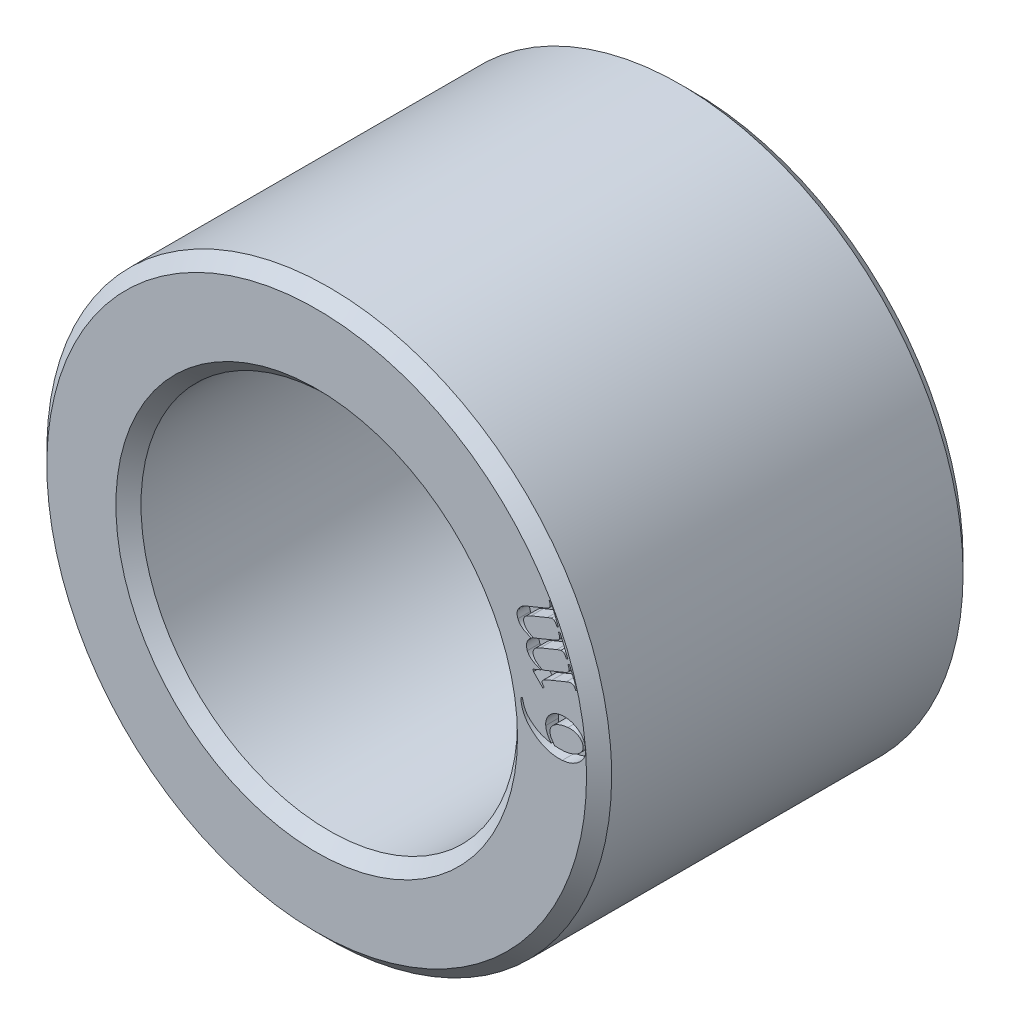
from build123d import *

# Parameters (mm, degrees)
ESQUISSE1_R             = 4.5
ESQUISSE1_R_2           = 3
BOSS_EXTRU_1_DEPTH      = 6
CHANFREIN1_SIZE         = 0.2
ENL_V_MAT_EXTRU_1_DEPTH = 0.2


with BuildPart() as part:
    # Esquisse1 → Boss.-Extru.1 (new body)
    with BuildSketch(Plane.XY):
        Circle(ESQUISSE1_R)
        Circle(ESQUISSE1_R_2, mode=Mode.SUBTRACT)
    extrude(amount=BOSS_EXTRU_1_DEPTH)

    # Chanfrein1
    chanfrein1_edges = [part.edges().sort_by_distance(p)[0] for p in [
        (-4.5, 0, 0),
        (-4.5, 0, 6),
        (-3, 0, 0),
        (-3, 0, 6),
    ]]
    chamfer(chanfrein1_edges, length=CHANFREIN1_SIZE)

    # Esquisse2 → Enlèv. mat.-Extru.1 (cut)
    # profile 1 of 2: a face of its own
    with BuildSketch(Plane.XY.offset(6)):
        with BuildLine():
            Line((3.25194932, 0.572860765), (3.278490311, 0.574984044))
            add(Edge.make_bspline(
                [(3.278490311, 0.574984044), (3.281525389, 0.560067916), (3.287325905, 0.531560827), (3.299139738, 0.491417619), (3.312428476, 0.455575734), (3.32856748, 0.423739737), (3.347549471, 0.394522298), (3.370170581, 0.366705743), (3.396057147, 0.339005764), (3.425556445, 0.312434456), (3.457531203, 0.287353528), (3.491355803, 0.264656236), (3.526450285, 0.24431234), (3.563493528, 0.226775229), (3.602772028, 0.211360089), (3.645165909, 0.198401935), (3.69049705, 0.186484074), (3.722138987, 0.180693134), (3.738392616, 0.17771848)],
                knots=[0, 0, 0, 0, 1.118842627, 2.138285908, 3.073925311, 3.925799372, 4.757286829, 5.631041582, 6.558890153, 7.542636783, 8.547306681, 9.544738667, 10.535631832, 11.527317395, 12.55563609, 13.635450993, 14.785393592, 16, 16, 16, 16], degree=3))
            add(Edge.make_bspline(
                [(3.738392616, 0.17771848), (3.731969343, 0.185766501), (3.719371531, 0.201550893), (3.702943483, 0.226325912), (3.688208645, 0.250969487), (3.676268345, 0.276182645), (3.665810449, 0.301351718), (3.65830045, 0.327019795), (3.652590651, 0.352766426), (3.650621336, 0.37013432), (3.649639539, 0.378793034)],
                knots=[0, 0, 0, 0, 1.106759844, 2.170661682, 3.194045375, 4.1914293, 5.168037007, 6.121565719, 7.063511999, 8, 8, 8, 8], degree=3))
            add(Edge.make_bspline(
                [(3.649639539, 0.378793034), (3.649180584, 0.387000673), (3.648273689, 0.403218935), (3.649989637, 0.427397553), (3.654597759, 0.450832259), (3.661284811, 0.473781392), (3.671050142, 0.495871142), (3.682997614, 0.517565868), (3.697685546, 0.538535635), (3.714878375, 0.558591987), (3.734006763, 0.577435861), (3.755124603, 0.594215256), (3.777773294, 0.608984095), (3.802064004, 0.621592854), (3.828095639, 0.63170787), (3.855652817, 0.63979829), (3.884844048, 0.645815451), (3.904975142, 0.647980295), (3.915261784, 0.649086493)],
                knots=[0, 0, 0, 0, 0.934317859, 1.846208399, 2.747664738, 3.64667381, 4.558848539, 5.488473313, 6.459853244, 7.464806702, 8.489426934, 9.508975385, 10.527092846, 11.560372039, 12.615709333, 13.698234171, 14.823837356, 16, 16, 16, 16], degree=3))
            add(Edge.make_bspline(
                [(3.915261784, 0.649086493), (3.92530858, 0.649773742), (3.94525496, 0.651138171), (3.975070588, 0.649789928), (4.004502343, 0.646822891), (4.033347619, 0.640905403), (4.061825796, 0.633153662), (4.089656083, 0.622576273), (4.117146457, 0.609964162), (4.134677036, 0.599694976), (4.143514313, 0.594518214)],
                knots=[0, 0, 0, 0, 1.011416008, 2.008012301, 2.995528033, 3.981915645, 4.964009732, 5.959005107, 6.971121403, 8, 8, 8, 8], degree=3))
            add(Edge.make_bspline(
                [(4.143514313, 0.594518214), (4.153877423, 0.587891008), (4.174191154, 0.574900382), (4.201145738, 0.55177259), (4.224596998, 0.526768795), (4.244365888, 0.4995607), (4.260305903, 0.470101586), (4.272676227, 0.438594855), (4.281622222, 0.40504303), (4.284231947, 0.381745989), (4.285561701, 0.36987526)],
                knots=[0, 0, 0, 0, 1.065992641, 2.089554928, 3.071329832, 4.034165826, 4.998488403, 5.968734537, 6.964992928, 8, 8, 8, 8], degree=3))
            add(Edge.make_bspline(
                [(4.285561701, 0.36987526), (4.28606828, 0.361738656), (4.287068248, 0.345677302), (4.285903091, 0.321792836), (4.282822301, 0.298669062), (4.27735462, 0.276307547), (4.270112775, 0.254633068), (4.260039563, 0.233984999), (4.248480632, 0.213746792), (4.238995857, 0.201259567), (4.234178341, 0.194917043)],
                knots=[0, 0, 0, 0, 1.045580687, 2.063937508, 3.063361908, 4.03494871, 5.014485605, 5.989632586, 6.97889217, 8, 8, 8, 8], degree=3))
            add(Edge.make_bspline(
                [(4.234178341, 0.194917043), (4.224211203, 0.183174535), (4.204483877, 0.159933328), (4.171153298, 0.12890792), (4.134764855, 0.102390703), (4.095956178, 0.079334674), (4.054099244, 0.06094868), (4.009619708, 0.046557101), (3.962537842, 0.035644978), (3.929965522, 0.032147109), (3.913350833, 0.030362895)],
                knots=[0, 0, 0, 0, 0.995190326, 1.969717452, 2.935222583, 3.901248004, 4.882455184, 5.883759233, 6.920534871, 8, 8, 8, 8], degree=3))
            add(Edge.make_bspline(
                [(3.913350833, 0.030362895), (3.902527244, 0.029632412), (3.880968436, 0.028177412), (3.848713849, 0.027666946), (3.816761924, 0.029301846), (3.785071724, 0.032182484), (3.753602004, 0.036884462), (3.722348832, 0.043270327), (3.691359214, 0.051301967), (3.660794128, 0.061161555), (3.630598966, 0.07230535), (3.601203351, 0.085335009), (3.572393014, 0.099561515), (3.544349175, 0.115326565), (3.516938831, 0.132463948), (3.490425629, 0.151281973), (3.464353373, 0.171222662), (3.439434157, 0.192669028), (3.415886637, 0.21488539), (3.393715567, 0.23690552), (3.373458175, 0.258905444), (3.355497158, 0.281199267), (3.338816116, 0.302855581), (3.324302389, 0.324647507), (3.311730446, 0.346375013), (3.297560374, 0.374764786), (3.283439825, 0.409983309), (3.26962043, 0.451312715), (3.259966512, 0.49167758), (3.25686377, 0.5183932), (3.255346567, 0.531456818)],
                knots=[0, 0, 0, 0, 1.000630422, 1.993091248, 2.973474395, 3.950547635, 4.927424542, 5.906937746, 6.891897131, 7.8788452, 8.868402735, 9.859445237, 10.843408774, 11.831392828, 12.825870199, 13.823920105, 14.82943738, 15.852708173, 16.855019809, 17.815261441, 18.734893224, 19.611818317, 20.455346098, 21.255701328, 22.025017986, 22.76955685, 24.180801152, 25.520729362, 26.78766646, 28, 28, 28, 28], degree=3))
            Line((3.255346567, 0.531456818), (3.25194932, 0.572860765))
        make_face()
        with BuildLine():
            add(Edge.make_bspline(
                [(3.791474599, 0.170074675), (3.807043052, 0.169413161), (3.836543856, 0.168159651), (3.878386126, 0.167838145), (3.915365683, 0.168181968), (3.938338922, 0.169763764), (3.949021926, 0.170499331)],
                knots=[0, 0, 0, 0, 1.186049358, 2.247455854, 3.185032808, 4, 4, 4, 4], degree=3))
            add(Edge.make_bspline(
                [(3.949021926, 0.170499331), (3.960730897, 0.171859029), (3.984677782, 0.174639849), (4.02095606, 0.182735926), (4.058349353, 0.194149466), (4.096322785, 0.208192651), (4.132929707, 0.225143347), (4.165619096, 0.245813149), (4.194496763, 0.268482682), (4.210019991, 0.286520697), (4.217616762, 0.295348156)],
                knots=[0, 0, 0, 0, 0.932306649, 1.906729348, 2.93619134, 4.024357782, 5.109146207, 6.120780669, 7.08034612, 8, 8, 8, 8], degree=3))
            add(Edge.make_bspline(
                [(4.217616762, 0.295348156), (4.222298175, 0.302048858), (4.231525518, 0.315256339), (4.24024686, 0.337965731), (4.244667277, 0.362200563), (4.244049973, 0.378777074), (4.243733098, 0.387286151)],
                knots=[0, 0, 0, 0, 0.999573115, 1.970217961, 2.958069589, 4, 4, 4, 4], degree=3))
            add(Edge.make_bspline(
                [(4.243733098, 0.387286151), (4.243166848, 0.392407173), (4.242043096, 0.402570103), (4.237840072, 0.417401966), (4.231878214, 0.431635322), (4.224161085, 0.445300199), (4.214753939, 0.458388518), (4.203323509, 0.470744221), (4.19015483, 0.4825825), (4.175315561, 0.493848283), (4.158890342, 0.504024752), (4.140832811, 0.512501485), (4.121490769, 0.519644085), (4.100499679, 0.524537591), (4.078242444, 0.528290171), (4.054503896, 0.529758468), (4.029398811, 0.530106666), (4.012220843, 0.528895427), (4.003377877, 0.528271899)],
                knots=[0, 0, 0, 0, 0.797375658, 1.582432957, 2.378978212, 3.184461456, 4.009500798, 4.871346871, 5.787797936, 6.750918358, 7.755559085, 8.776122963, 9.837944095, 10.9447092, 12.111491027, 13.332249014, 14.626680805, 16, 16, 16, 16], degree=3))
            add(Edge.make_bspline(
                [(4.003377877, 0.528271899), (3.993315718, 0.527237015), (3.973552674, 0.525204403), (3.944614985, 0.520542782), (3.916890983, 0.514377533), (3.890298636, 0.506725339), (3.864799412, 0.497661409), (3.840545382, 0.486926898), (3.81732858, 0.475120813), (3.79556488, 0.461832313), (3.775753687, 0.447431574), (3.758439619, 0.431887552), (3.744378375, 0.415026294), (3.73307801, 0.397135669), (3.724758286, 0.378171856), (3.719380708, 0.358137153), (3.717006214, 0.337083575), (3.717669995, 0.322811307), (3.718009134, 0.315519309)],
                knots=[0, 0, 0, 0, 1.229182765, 2.414232826, 3.559950575, 4.678877195, 5.775360219, 6.846135649, 7.900231693, 8.93880598, 9.941827248, 10.873404953, 11.758887611, 12.601379669, 13.437214743, 14.265580502, 15.113849116, 16, 16, 16, 16], degree=3))
            add(Edge.make_bspline(
                [(3.718009134, 0.315519309), (3.719458482, 0.306100881), (3.722508878, 0.286278225), (3.732123406, 0.261512704), (3.743847945, 0.239707226), (3.756619147, 0.219622244), (3.77245695, 0.195739547), (3.784806279, 0.179073767), (3.791474599, 0.170074675)],
                knots=[0, 0, 0, 0, 1.037336687, 2.183248309, 2.874082515, 3.737562703, 4.77834208, 6, 6, 6, 6], degree=3))
        make_face(mode=Mode.SUBTRACT)
    # profile 2 of 2: a face of its own
    with BuildSketch(Plane.XY.offset(6)):
        with BuildLine():
            add(Edge.make_bspline(
                [(3.572162439, 1.107246736), (3.564806912, 1.110373127), (3.550882599, 1.116291514), (3.531132154, 1.124466799), (3.51397501, 1.131925961), (3.499283207, 1.138362747), (3.486902914, 1.143594896), (3.477043682, 1.148090179), (3.46951475, 1.151361804), (3.465494155, 1.15351608), (3.463875193, 1.154383537)],
                knots=[0, 0, 0, 0, 1.623905956, 3.074120309, 4.343024765, 5.425002441, 6.333248957, 7.073526645, 7.626939511, 8, 8, 8, 8], degree=3))
            add(Edge.make_bspline(
                [(3.463875193, 1.154383537), (3.457796736, 1.1576769), (3.44570814, 1.16422661), (3.428783636, 1.175834279), (3.41274127, 1.188290919), (3.398115016, 1.202098593), (3.385062557, 1.216826657), (3.373630297, 1.232279356), (3.364047049, 1.248375905), (3.35895449, 1.25964731), (3.356437259, 1.265218718)],
                knots=[0, 0, 0, 0, 1.052579463, 2.093328383, 3.122280231, 4.144429767, 5.152721725, 6.116741927, 7.069113377, 8, 8, 8, 8], degree=3))
            add(Edge.make_bspline(
                [(3.356437259, 1.265218718), (3.35297769, 1.274607125), (3.346243318, 1.292882532), (3.342095585, 1.321485384), (3.342619965, 1.349730737), (3.348462504, 1.377505685), (3.359246898, 1.404271496), (3.375728164, 1.428960883), (3.396719705, 1.452166664), (3.41393946, 1.46495166), (3.422895902, 1.47160147)],
                knots=[0, 0, 0, 0, 1.013741976, 1.973343196, 2.915175001, 3.86951262, 4.839874858, 5.826708353, 6.869614434, 8, 8, 8, 8], degree=3))
            add(Edge.make_bspline(
                [(3.422895902, 1.47160147), (3.414249663, 1.474539484), (3.397525052, 1.480222549), (3.373508924, 1.489008848), (3.351676898, 1.498289295), (3.33157958, 1.507072192), (3.31359378, 1.516176894), (3.297578936, 1.525324283), (3.283507087, 1.53442423), (3.267457835, 1.546462183), (3.250358096, 1.56277155), (3.232508157, 1.583678683), (3.217570573, 1.606312952), (3.210213602, 1.622667221), (3.206533738, 1.63084742)],
                knots=[0, 0, 0, 0, 1.181462662, 2.28532929, 3.307358082, 4.250098007, 5.122342738, 5.913960471, 6.635250386, 7.289041303, 8.506916775, 9.682866614, 10.840999088, 12, 12, 12, 12], degree=3))
            add(Edge.make_bspline(
                [(3.206533738, 1.63084742), (3.203606922, 1.638845811), (3.197880717, 1.654494361), (3.193436544, 1.67886062), (3.192578495, 1.703030243), (3.195223967, 1.727265261), (3.20258819, 1.751325945), (3.214876017, 1.774926476), (3.231560284, 1.798357803), (3.24565678, 1.812446557), (3.253033555, 1.819819281)],
                knots=[0, 0, 0, 0, 0.978377517, 1.914158631, 2.834763428, 3.752772326, 4.705750932, 5.710733084, 6.802013794, 8, 8, 8, 8], degree=3))
            add(Edge.make_bspline(
                [(3.253033555, 1.819819281), (3.259342977, 1.825168382), (3.273323225, 1.837020775), (3.299615063, 1.852163871), (3.331370986, 1.868664763), (3.35514528, 1.878607094), (3.367902967, 1.883942317)],
                knots=[0, 0, 0, 0, 0.749801465, 1.661389949, 2.745062352, 4, 4, 4, 4], degree=3))
            Line((3.367902967, 1.883942317), (3.629278653, 1.991167923))
            add(Edge.make_bspline(
                [(3.629278653, 1.991167923), (3.638035152, 1.994810378), (3.654101332, 2.001493451), (3.675273662, 2.012086811), (3.691822559, 2.021544001), (3.70033774, 2.02865089), (3.704018086, 2.031722559)],
                knots=[0, 0, 0, 0, 1.332011758, 2.443938192, 3.327454534, 4, 4, 4, 4], degree=3))
            add(Edge.make_bspline(
                [(3.704018086, 2.031722559), (3.70587103, 2.034001107), (3.709645902, 2.038643033), (3.713887829, 2.046945438), (3.717051755, 2.056304499), (3.719044029, 2.067017581), (3.719196126, 2.079575369), (3.716900496, 2.094226089), (3.712030433, 2.111092396), (3.707513886, 2.122846363), (3.705079726, 2.12918108)],
                knots=[0, 0, 0, 0, 0.682551815, 1.390515001, 2.156918714, 2.978274093, 3.918152987, 5.067610776, 6.419609747, 8, 8, 8, 8], degree=3))
            Line((3.705079726, 2.12918108), (3.729072782, 2.138948165))
            Line((3.729072782, 2.138948165), (3.852010656, 1.839141123))
            Line((3.852010656, 1.839141123), (3.828017599, 1.829374038))
            Line((3.828017599, 1.829374038), (3.822921729, 1.841901386))
            add(Edge.make_bspline(
                [(3.822921729, 1.841901386), (3.820233398, 1.847989465), (3.81511531, 1.859580049), (3.805617806, 1.874967777), (3.794944712, 1.887451134), (3.786726634, 1.893693227), (3.782791749, 1.896681993)],
                knots=[0, 0, 0, 0, 1.158606346, 2.205773614, 3.14090945, 4, 4, 4, 4], degree=3))
            add(Edge.make_bspline(
                [(3.782791749, 1.896681993), (3.779882621, 1.898391828), (3.773922249, 1.901895026), (3.763451146, 1.90434162), (3.752032918, 1.905832624), (3.744080607, 1.905123247), (3.739901507, 1.904750454)],
                knots=[0, 0, 0, 0, 0.905014936, 1.854240994, 2.872360431, 4, 4, 4, 4], degree=3))
            add(Edge.make_bspline(
                [(3.739901507, 1.904750454), (3.736989851, 1.904005222), (3.72937138, 1.90205529), (3.71559359, 1.897162054), (3.696743978, 1.889890071), (3.682494828, 1.884174678), (3.674504503, 1.880969726)],
                knots=[0, 0, 0, 0, 0.517720444, 1.354637207, 2.516591618, 4, 4, 4, 4], degree=3))
            Line((3.674504503, 1.880969726), (3.413128817, 1.773744119))
            add(Edge.make_bspline(
                [(3.413128817, 1.773744119), (3.401699176, 1.768855933), (3.380588785, 1.759827521), (3.352977198, 1.744452433), (3.330832094, 1.729880328), (3.320230616, 1.71810645), (3.315457968, 1.712806002)],
                knots=[0, 0, 0, 0, 1.282740433, 2.369203903, 3.265836688, 4, 4, 4, 4], degree=3))
            add(Edge.make_bspline(
                [(3.315457968, 1.712806002), (3.313038339, 1.709177224), (3.308264066, 1.702017124), (3.302644507, 1.69051632), (3.299043811, 1.678458243), (3.29710209, 1.666025193), (3.296949202, 1.653103256), (3.298384728, 1.639737109), (3.301940891, 1.626046399), (3.305258267, 1.61701895), (3.30696485, 1.61237489)],
                knots=[0, 0, 0, 0, 0.989361261, 1.952151423, 2.892294101, 3.835177725, 4.799173301, 5.81745619, 6.877217166, 8, 8, 8, 8], degree=3))
            add(Edge.make_bspline(
                [(3.30696485, 1.61237489), (3.309659515, 1.60656983), (3.315092732, 1.594865162), (3.325840649, 1.578471707), (3.338824179, 1.56311546), (3.35394269, 1.547952398), (3.373040788, 1.533650607), (3.396038798, 1.519046593), (3.423533002, 1.504224915), (3.443646619, 1.494980036), (3.454320436, 1.490074)],
                knots=[0, 0, 0, 0, 0.781427539, 1.575582129, 2.386287755, 3.236501389, 4.186350593, 5.294937417, 6.564487839, 8, 8, 8, 8], degree=3))
            Line((3.454320436, 1.490074), (3.46217657, 1.491560296))
            Line((3.46217657, 1.491560296), (3.489991529, 1.504724628))
            Line((3.489991529, 1.504724628), (3.780031486, 1.62362827))
            add(Edge.make_bspline(
                [(3.780031486, 1.62362827), (3.784992056, 1.625665553), (3.794379921, 1.629521104), (3.807654997, 1.635245334), (3.819301679, 1.64077487), (3.829397363, 1.64585309), (3.838060564, 1.650280324), (3.845112354, 1.654498297), (3.850556099, 1.658444917), (3.855882096, 1.663090485), (3.860852843, 1.669394182), (3.865040631, 1.678149447), (3.868303344, 1.687966915), (3.87003029, 1.699435967), (3.869704665, 1.713064868), (3.866721164, 1.729250691), (3.861032199, 1.748262455), (3.855735624, 1.76161248), (3.852859968, 1.768860577)],
                knots=[0, 0, 0, 0, 1.304896122, 2.469512162, 3.517223659, 4.441450146, 5.21949327, 5.884046106, 6.438635482, 6.853394811, 7.601112826, 8.371301565, 9.204566053, 10.110643269, 11.17854266, 12.506420418, 14.103239193, 16, 16, 16, 16], degree=3))
            Line((3.852859968, 1.768860577), (3.876853024, 1.778627662))
            Line((3.876853024, 1.778627662), (4.002763489, 1.471389142))
            Line((4.002763489, 1.471389142), (3.978770432, 1.461622057))
            add(Edge.make_bspline(
                [(3.978770432, 1.461622057), (3.97551024, 1.469330569), (3.969509102, 1.483519871), (3.959388478, 1.502040647), (3.949540881, 1.516301503), (3.939237392, 1.526204904), (3.928370868, 1.532510457), (3.916942163, 1.536247086), (3.904661642, 1.538380068), (3.896251295, 1.537748012), (3.891928307, 1.537423129)],
                knots=[0, 0, 0, 0, 1.59596613, 2.937745548, 4.020916702, 4.890315078, 5.640719186, 6.396571166, 7.175824508, 8, 8, 8, 8], degree=3))
            add(Edge.make_bspline(
                [(3.891928307, 1.537423129), (3.888943307, 1.536835169), (3.881078872, 1.535286097), (3.866943737, 1.530510093), (3.847614248, 1.523197686), (3.833031986, 1.517353258), (3.82483268, 1.514067057)],
                knots=[0, 0, 0, 0, 0.51272494, 1.350851719, 2.510438444, 4, 4, 4, 4], degree=3))
            Line((3.82483268, 1.514067057), (3.563456994, 1.40684145))
            add(Edge.make_bspline(
                [(3.563456994, 1.40684145), (3.552010541, 1.401915711), (3.530763068, 1.392772311), (3.502978708, 1.376597112), (3.4809173, 1.360193736), (3.47052885, 1.347175443), (3.465786145, 1.341232119)],
                knots=[0, 0, 0, 0, 1.254065377, 2.327858114, 3.236606435, 4, 4, 4, 4], degree=3))
            add(Edge.make_bspline(
                [(3.465786145, 1.341232119), (3.463427184, 1.337390444), (3.458760803, 1.329791032), (3.453516514, 1.317718845), (3.449800991, 1.305471265), (3.447862969, 1.293033947), (3.447720121, 1.280473965), (3.448989325, 1.267707739), (3.451965618, 1.254809183), (3.45507684, 1.246362412), (3.456656043, 1.242074974)],
                knots=[0, 0, 0, 0, 1.040030415, 2.057337243, 3.029527056, 3.98885427, 4.95331941, 5.922619685, 6.945556802, 8, 8, 8, 8], degree=3))
            add(Edge.make_bspline(
                [(3.456656043, 1.242074974), (3.459316145, 1.236177332), (3.464644803, 1.224363304), (3.475928358, 1.208044958), (3.489123574, 1.192528713), (3.499563507, 1.183418382), (3.504854484, 1.178801249)],
                knots=[0, 0, 0, 0, 0.964760881, 1.932588267, 2.952231921, 4, 4, 4, 4], degree=3))
            add(Edge.make_bspline(
                [(3.504854484, 1.178801249), (3.513376096, 1.172061877), (3.529741262, 1.159119377), (3.555272999, 1.142882167), (3.580197578, 1.12982789), (3.597278743, 1.123900308), (3.605497925, 1.121048052)],
                knots=[0, 0, 0, 0, 1.11616242, 2.14351296, 3.106688336, 4, 4, 4, 4], degree=3))
            Line((3.605497925, 1.121048052), (3.931208975, 1.254602322))
            add(Edge.make_bspline(
                [(3.931208975, 1.254602322), (3.940242978, 1.258394856), (3.95663345, 1.265275686), (3.978040927, 1.275843745), (3.994090513, 1.284879667), (4.005025302, 1.293609298), (4.012020634, 1.302368602), (4.017226272, 1.311053469), (4.020633053, 1.320425356), (4.022789474, 1.330790679), (4.02237563, 1.343459401), (4.018716363, 1.359056662), (4.012746949, 1.378451213), (4.007131333, 1.392375491), (4.004037456, 1.400046956)],
                knots=[0, 0, 0, 0, 1.785548556, 3.239536754, 4.350269636, 5.138215426, 5.770917799, 6.383843317, 6.975770077, 7.580493724, 8.303095763, 9.264585961, 10.492946419, 12, 12, 12, 12], degree=3))
            Line((4.004037456, 1.400046956), (4.028030513, 1.409814041))
            Line((4.028030513, 1.409814041), (4.151393042, 1.109157687))
            Line((4.151393042, 1.109157687), (4.127399986, 1.099390602))
            add(Edge.make_bspline(
                [(4.127399986, 1.099390602), (4.12465061, 1.105795031), (4.1195908, 1.117581411), (4.111510393, 1.13326998), (4.103158082, 1.145073551), (4.09511479, 1.153994753), (4.086286175, 1.159966094), (4.076901558, 1.164292077), (4.066517808, 1.166752778), (4.054796498, 1.167948395), (4.040470509, 1.166695831), (4.022765525, 1.16188815), (4.00068705, 1.155039105), (3.984878294, 1.148578497), (3.976222497, 1.145041108)],
                knots=[0, 0, 0, 0, 1.326990168, 2.442124337, 3.350564975, 4.074885445, 4.713991743, 5.365197538, 6.031831668, 6.735687325, 7.600621675, 8.750934106, 10.221032955, 12, 12, 12, 12], degree=3))
            Line((3.976222497, 1.145041108), (3.743935738, 1.049705866))
            add(Edge.make_bspline(
                [(3.743935738, 1.049705866), (3.735933271, 1.046391016), (3.72075302, 1.040102922), (3.699146714, 1.030943278), (3.679935814, 1.022429449), (3.662769361, 1.014875074), (3.648149078, 1.007645949), (3.635635233, 1.001463236), (3.625419242, 0.996081077), (3.619562939, 0.992339424), (3.616963633, 0.9906787)],
                knots=[0, 0, 0, 0, 1.483205459, 2.813561621, 4.018250363, 5.08143069, 6.024551516, 6.810433626, 7.472013879, 8, 8, 8, 8], degree=3))
            add(Edge.make_bspline(
                [(3.616963633, 0.9906787), (3.613935122, 0.988484356), (3.608270083, 0.984379683), (3.601207456, 0.977641758), (3.596051952, 0.970845056), (3.591685236, 0.961764271), (3.59048524, 0.948415806), (3.593888189, 0.938504609), (3.59573084, 0.93313783)],
                knots=[0, 0, 0, 0, 0.991173528, 1.854058804, 2.578655657, 3.2420695, 4.506618188, 6, 6, 6, 6], degree=3))
            add(Edge.make_bspline(
                [(3.59573084, 0.93313783), (3.597235812, 0.929996502), (3.600430334, 0.92332858), (3.606591888, 0.913371336), (3.614632598, 0.903117212), (3.620740549, 0.89636573), (3.623970455, 0.892795523)],
                knots=[0, 0, 0, 0, 0.844377537, 1.792313299, 2.832567438, 4, 4, 4, 4], degree=3))
            Line((3.623970455, 0.892795523), (3.604011629, 0.873049025))
            Line((3.604011629, 0.873049025), (3.454532764, 1.025712809))
            Line((3.454532764, 1.025712809), (3.442854728, 1.054164752))
            Line((3.442854728, 1.054164752), (3.572162439, 1.107246736))
        make_face()
    extrude(amount=-ENL_V_MAT_EXTRU_1_DEPTH, mode=Mode.SUBTRACT)


solid = part.part
